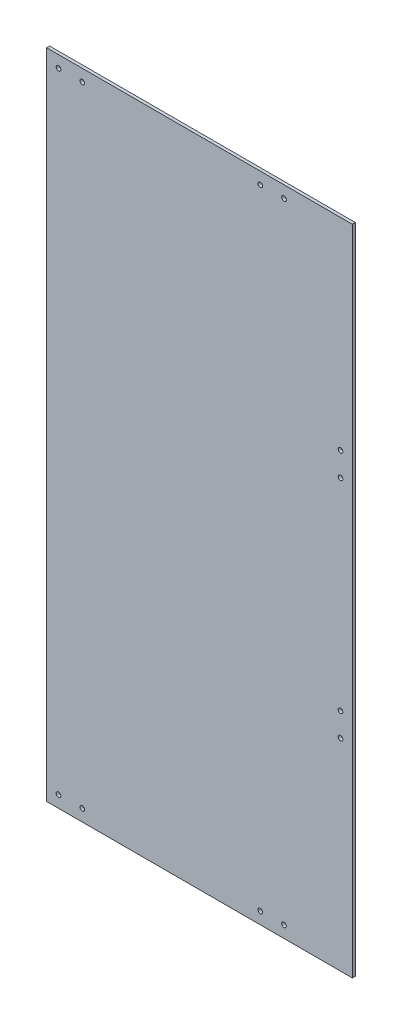
from build123d import *

# Parameters (mm, degrees)
SKETCH1_W                  = 698.5
SKETCH1_H                  = 327.152
BOSS_EXTRUDE1_DEPTH        = 3.175
F_9_0_196_DIAMETER_HOLE2_D = 4.9784


with BuildPart() as part:
    # Sketch1 → Boss-Extrude1 (new body)
    with BuildSketch(Plane(origin=(0, 0, 0), x_dir=(0, 1, 0), z_dir=(0, 0, 1))):
        Rectangle(SKETCH1_W, SKETCH1_H)
    extrude(amount=BOSS_EXTRUDE1_DEPTH)

    # #9 (0.196) Diameter Hole2 (through all)
    with Locations(Plane.XY.offset(3.175)):
        with Locations((-150.876, 336.55), (-125.476, 336.55), (65.024, 336.55), (90.424, 336.55), (90.424, -336.55), (65.024, -336.55), (-125.476, -336.55), (-150.876, -336.55), (-371.836153613, -199.719855434), (150.876, 133.35), (150.876, 107.95), (150.876, -107.95), (150.876, -133.35)):
            Hole(F_9_0_196_DIAMETER_HOLE2_D / 2)


solid = part.part
